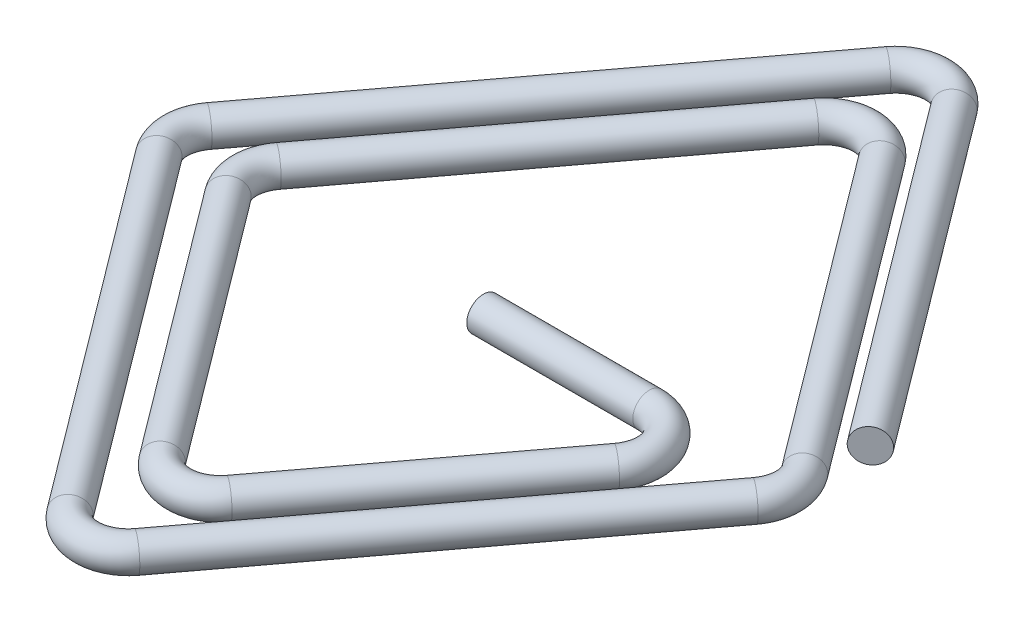
from build123d import *

# Parameters (mm, degrees)
SKETCH_3_R = 0.6


with BuildPart() as part:
    # По траектории1: sweep along a path in Эскиз2
    with BuildLine(Plane(origin=(0, 0, 0), x_dir=(1, 0, 0), z_dir=(0, 1, 0))) as sweep_1_path:
        Line((11.1375, 2.85), (2.0875, 14.916666667))
        ThreePointArc((2.0875, 14.916666667), (0.8875, 15.516666667), (-0.3125, 14.916666667))
        Line((-0.3125, 14.916666667), (-10.825, 0.9))
        ThreePointArc((-10.825, 0.9), (-11.125, 0), (-10.825, -0.9))
        Line((-10.825, -0.9), (-1.2, -13.733333333))
        ThreePointArc((-1.2, -13.733333333), (0, -14.333333333), (1.2, -13.733333333))
        Line((1.2, -13.733333333), (10.775, -0.966666667))
        ThreePointArc((10.775, -0.966666667), (11.075, -0.066666667), (10.775, 0.833333333))
        Line((10.775, 0.833333333), (2.4, 12))
        ThreePointArc((2.4, 12), (1.2, 12.6), (0, 12))
        Line((0, 12), (-8.325, 0.9))
        ThreePointArc((-8.325, 0.9), (-8.625, 0), (-8.325, -0.9))
        Line((-8.325, -0.9), (-1.2, -10.4))
        ThreePointArc((-1.2, -10.4), (0, -11), (1.2, -10.4))
        Line((1.2, -10.4), (7.2, -2.4))
        ThreePointArc((7.2, -2.4), (7.341640786, -0.829179607), (6, 0))
        Line((6, 0), (0, 0))
    # Эскиз3 → По траектории1 (sweep)
    with BuildSketch(Plane(origin=(11.1375, 0, -2.85), x_dir=(0.7999999999999999, 0, -0.6000000000000002), z_dir=(0.6000000000000001, 0, 0.7999999999999998))):
        Circle(SKETCH_3_R)
    sweep(path=sweep_1_path.line)


solid = part.part
